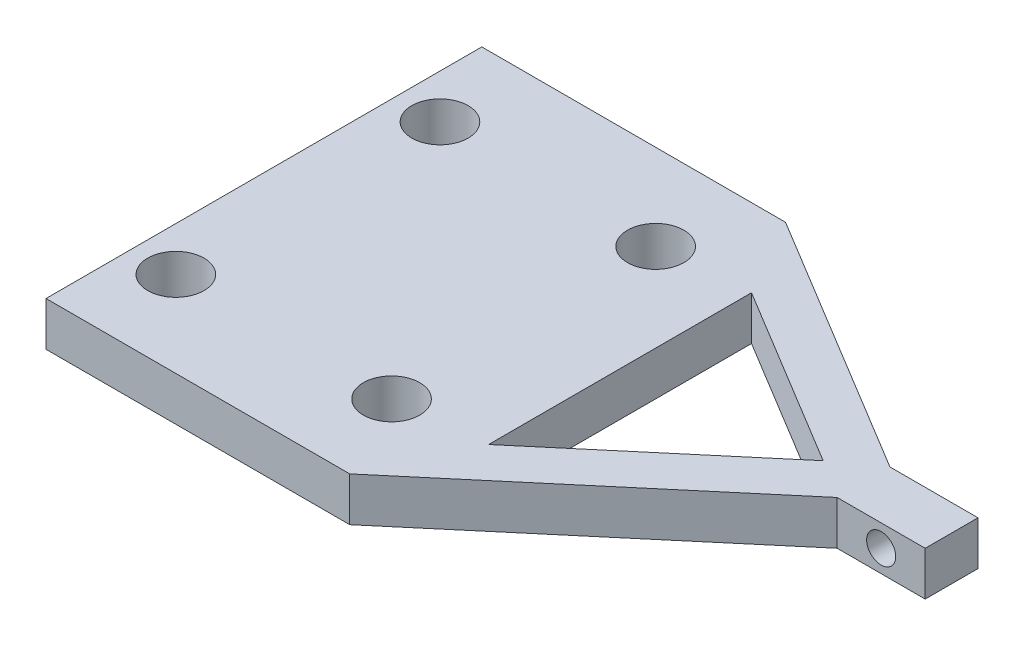
from build123d import *

# Parameters (mm, degrees)
SKETCH1_W           = 34.5
SKETCH1_H           = 49.5
BOSS_EXTRUDE1_DEPTH = 5
SKETCH2_R           = 3.2
CUT_EXTRUDE1_DEPTH  = 5
SKETCH3_W           = 6
SKETCH3_H           = 25
BOSS_EXTRUDE2_DEPTH = 5
FILLET1_R           = 10
FILLET2_R           = 5
SKETCH6_W           = 166.1846994
SKETCH6_H           = 49.5
CUT_EXTRUDE3_DEPTH  = 10
BOSS_EXTRUDE3_DEPTH = 5
SKETCH8_R           = 1.65
CUT_EXTRUDE4_DEPTH  = 10


with BuildPart() as part:
    # Sketch1 → Boss-Extrude1 (new body)
    with BuildSketch(Plane(origin=(0, 0, 0), x_dir=(1, 0, 0), z_dir=(0, 1, 0))):
        with Locations((17.25, 24.75)):
            Rectangle(SKETCH1_W, SKETCH1_H)
    extrude(amount=BOSS_EXTRUDE1_DEPTH)

    # Sketch2 → Cut-Extrude1 (cut)
    with BuildSketch(Plane(origin=(0, 5, 0), x_dir=(1, 0, 0), z_dir=(0, 1, 0))):
        with Locations(Location((5, 39.75, 0), (0, 0, 270))):
            Circle(SKETCH2_R)
        with Locations(Location((5, 9.75, 0), (0, 0, 90))):
            Circle(SKETCH2_R)
        with Locations(Location((29.5, 9.75, 0), (0, 0, 270))):
            Circle(SKETCH2_R)
        with Locations(Location((29.5, 39.75, 0), (0, 0, 90))):
            Circle(SKETCH2_R)
    extrude(amount=-CUT_EXTRUDE1_DEPTH, mode=Mode.SUBTRACT)

    # Sketch3 → Boss-Extrude2 (add)
    with BuildSketch(Plane(origin=(0, 5, 0), x_dir=(1, 0, 0), z_dir=(0, 1, 0))):
        Polygon((189.75, 42.25), (34.5, 49.5), (34.5, 41.491281612), (84.094915791, 39.175254948), (84.094915791, 10.324745052), (34.5, 8.008718388), (34.5, 0), (189.75, 7.25), align=None)
        Polygon((171.053500921, 14.385612956), (89.094915791, 10.558239416), (89.094915791, 38.941760584), (171.053500921, 35.114387044), align=None, mode=Mode.SUBTRACT)
        with Locations((181.13, 24.75)):
            Rectangle(SKETCH3_W, SKETCH3_H, mode=Mode.SUBTRACT)
    extrude(amount=-BOSS_EXTRUDE2_DEPTH)

    # Fillet1
    fillet1_edges = [part.edges().sort_by_distance(p)[0] for p in [
        (34.5, 2.5, -8.008718388),
        (84.094915791, 2.5, -10.324745052),
        (84.094915791, 2.5, -39.175254948),
        (34.5, 2.5, -41.491281612),
        (89.094915791, 2.5, -38.941760584),
        (89.094915791, 2.5, -10.558239416),
    ]]
    fillet(fillet1_edges, radius=FILLET1_R)

    # Fillet2
    fillet2_edges = [part.edges().sort_by_distance(p)[0] for p in [
        (171.053500921, 2.5, -35.114387044),
        (171.053500921, 2.5, -14.385612956),
    ]]
    fillet(fillet2_edges, radius=FILLET2_R)

    # Sketch6 → Cut-Extrude3 (cut)
    with BuildSketch(Plane(origin=(0, 5, 0), x_dir=(1, 0, 0), z_dir=(0, 1, 0))):
        with Locations((117.5923497, 24.75)):
            Rectangle(SKETCH6_W, SKETCH6_H)
    extrude(amount=-CUT_EXTRUDE3_DEPTH, mode=Mode.SUBTRACT)

    # Sketch7 → Boss-Extrude3 (add)
    with BuildSketch(Plane(origin=(0, 5, 0), x_dir=(1, 0, 0), z_dir=(0, 1, 0))):
        Polygon((64.5, 31.360565584), (34.5, 49.5), (34.5, 0), (64.5, 25.360565584), (74.5, 25.360565584), (74.5, 31.360565584), align=None)
        Polygon((60.093022172, 28.182292814), (39.5, 40.633818652), (39.5, 10.773936502), align=None, mode=Mode.SUBTRACT)
    extrude(amount=-BOSS_EXTRUDE3_DEPTH)

    # Sketch8 → Cut-Extrude4 (cut)
    with BuildSketch(Plane.XY.offset(-25.360565584)):
        with Locations((69.5, 2.5)):
            Circle(SKETCH8_R)
    extrude(amount=-CUT_EXTRUDE4_DEPTH, mode=Mode.SUBTRACT)


solid = part.part
